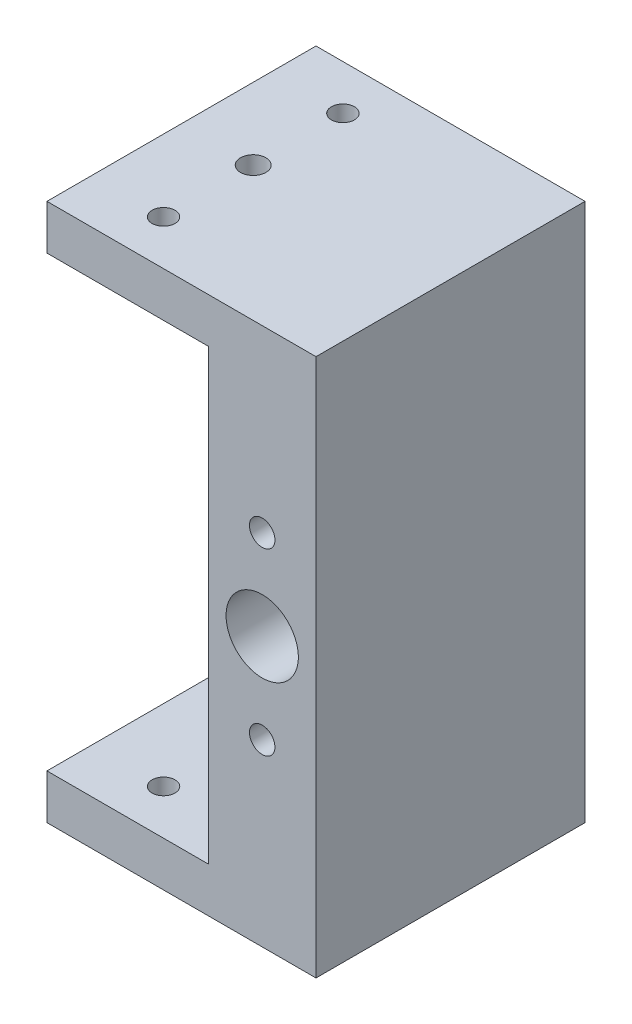
from build123d import *

# Parameters (mm, degrees)
SKETCH1_W           = 38.1
SKETCH1_H           = 76.2
BOSS_EXTRUDE1_DEPTH = 38.1
SKETCH2_W           = 22.86
SKETCH2_H           = 63.5
CUT_EXTRUDE1_DEPTH  = 38.1
SKETCH3_R           = 5.1181
SKETCH3_R_2         = 1.8034
CUT_EXTRUDE2_DEPTH  = 38.1
SKETCH4_R           = 1.6256
SKETCH4_R_2         = 1.8034
CUT_EXTRUDE3_DEPTH  = 76.2


with BuildPart() as part:
    # Sketch1 → Boss-Extrude1 (new body)
    with BuildSketch(Plane.XY):
        Rectangle(SKETCH1_W, SKETCH1_H)
    extrude(amount=BOSS_EXTRUDE1_DEPTH)

    # Sketch2 → Cut-Extrude1 (cut)
    with BuildSketch(Plane(origin=(0, 0, 0), x_dir=(-1, 0, 0), z_dir=(0, 0, -1))):
        with Locations((7.62, 0)):
            Rectangle(SKETCH2_W, SKETCH2_H)
    extrude(amount=-CUT_EXTRUDE1_DEPTH, mode=Mode.SUBTRACT)

    # Sketch3 → Cut-Extrude2 (cut)
    with BuildSketch(Plane(origin=(0, 0, 0), x_dir=(-1, 0, 0), z_dir=(0, 0, -1))):
        with Locations((-11.43, 0)):
            Circle(SKETCH3_R)
        with Locations((-11.43, -12.7)):
            Circle(SKETCH3_R_2)
        with Locations((-11.43, 12.7)):
            Circle(SKETCH3_R_2)
    extrude(amount=-CUT_EXTRUDE2_DEPTH, mode=Mode.SUBTRACT)

    # Sketch4 → Cut-Extrude3 (cut)
    with BuildSketch(Plane(origin=(0, -38.1, 0), x_dir=(-1, 0, 0), z_dir=(0, -1, 0))):
        with Locations(Location((8.89, -6.35, 0), (0, 0, 90))):
            Circle(SKETCH4_R)
        with Locations(Location((8.89, -19.05, 0), (0, 0, 90))):
            Circle(SKETCH4_R_2)
        with Locations(Location((8.89, -31.75, 0), (0, 0, 90))):
            Circle(SKETCH4_R)
    extrude(amount=-CUT_EXTRUDE3_DEPTH, mode=Mode.SUBTRACT)


solid = part.part
